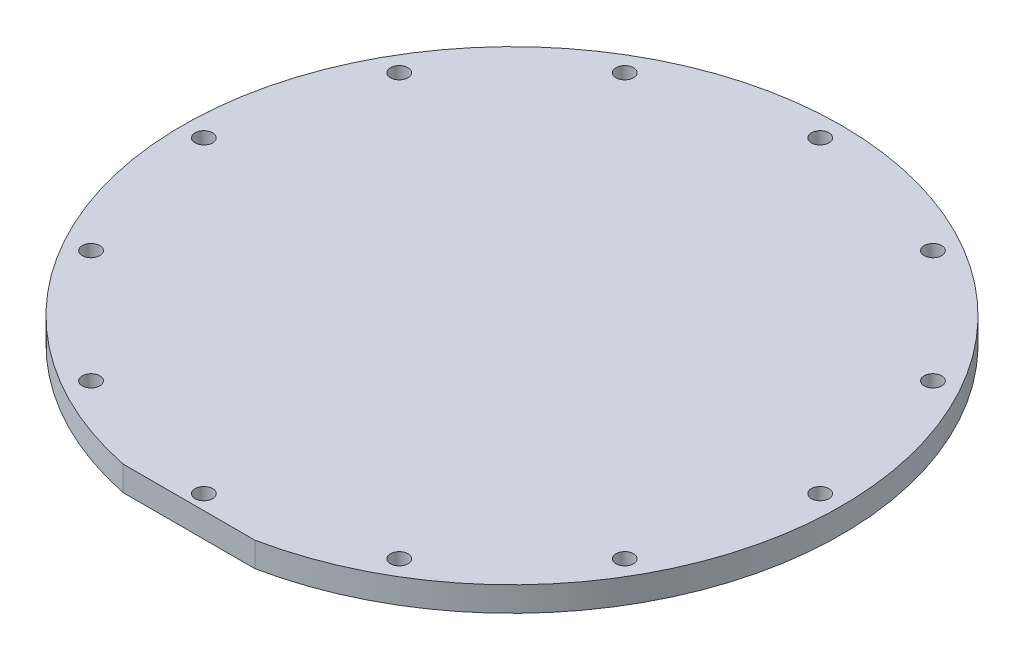
from build123d import *

# Parameters (mm, degrees)
SKETCH1_W               = 127
SKETCH1_H               = 9.525
F_1_4_CLEARANCE_HOLE1_D = 6.7564
CUT_EXTRUDE1_REACH      = 181.858
SKETCH4_W               = 50.8
SKETCH4_H               = 2.565921067


with BuildPart() as part:
    # Sketch1 → Revolve1 (revolve)
    with BuildSketch(Plane.XY, mode=Mode.PRIVATE) as revolve1_sk:
        with Locations((63.5, 4.7625)):
            Rectangle(SKETCH1_W, SKETCH1_H)
    revolve(revolve1_sk.sketch.rotate(Axis((0, 0, 0), (0, 1, 0)), 90), axis=Axis((0, 0, 0), (0, 1, 0)))

    # 1/4 Clearance Hole1 (through all)
    with Locations(Plane(origin=(0, 9.525, 0), x_dir=(1, 0, 0), z_dir=(0, 1, 0))):
        with Locations((0, 118.745), (59.3725, 102.836186572), (102.836186572, 59.3725), (118.745, 0), (102.836186572, -59.3725), (59.3725, -102.836186572), (0, -118.745), (-59.3725, -102.836186572), (-102.836186572, -59.3725), (-118.745, 0), (-102.836186572, 59.3725), (-59.3725, 102.836186572)):
            Hole(F_1_4_CLEARANCE_HOLE1_D / 2)

    # Sketch4 → Cut-Extrude1 (cut, up to next)
    with BuildSketch(Plane(origin=(0, 9.525, 0), x_dir=(1, 0, 0), z_dir=(0, 1, 0)), mode=Mode.PRIVATE) as cut_extrude1_sk1:
        with Locations((0, -125.717039467)):
            Rectangle(SKETCH4_W, SKETCH4_H)
    cut_extrude1_tool1 = extrude(cut_extrude1_sk1.sketch, amount=-CUT_EXTRUDE1_REACH, mode=Mode.PRIVATE) & part.part
    add(cut_extrude1_tool1.solids().sort_by_distance((0, 9.525, 125.717039))[0], mode=Mode.SUBTRACT)


solid = part.part
